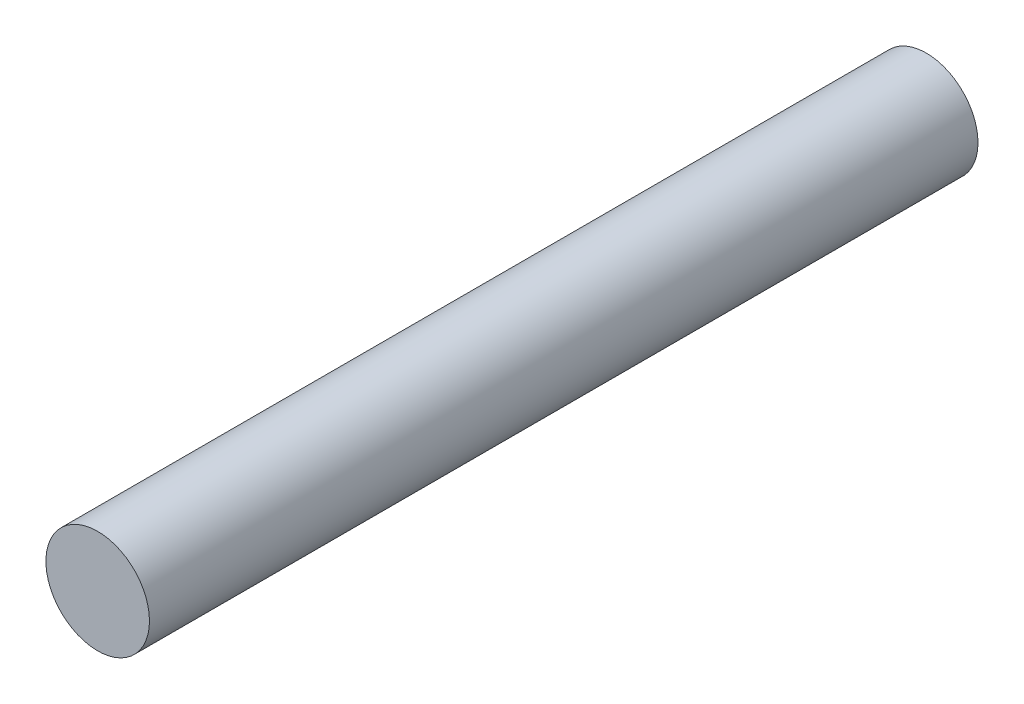
from build123d import *

# Parameters (mm, degrees)
CROQUIS1_R              = 2.5
SALIENTE_EXTRUIR1_DEPTH = 40


with BuildPart() as part:
    # Croquis1 → Saliente-Extruir1 (new body)
    with BuildSketch(Plane.XY):
        Circle(CROQUIS1_R)
    extrude(amount=SALIENTE_EXTRUIR1_DEPTH)


solid = part.part
